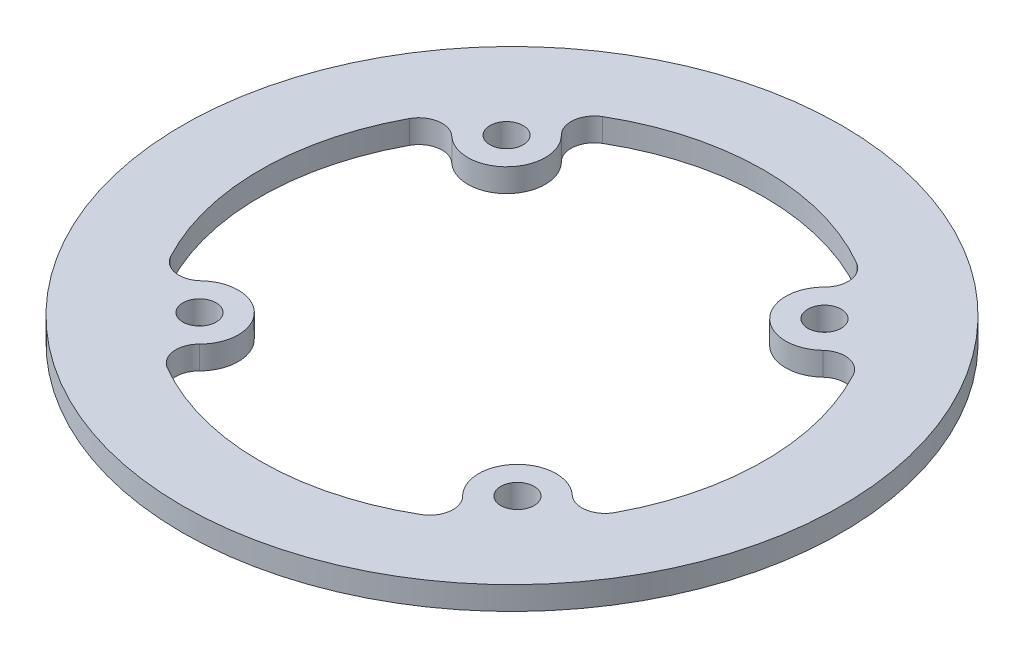
from build123d import *

# Parameters (mm, degrees)
SKETCH_1_R          = 45
SKETCH_1_R_2        = 2
EXTRUDE_1_DEPTH     = 3
CUT_EXTRUDE_1_DEPTH = 64.710281745
FILLET_1_R          = 3
MOVE_FACE_1_BY      = 2.5
MOVE_FACE_2_BY      = 0.15
MOVE_FACE_2_2_BY    = 0.15
MOVE_FACE_2_3_BY    = 0.15
MOVE_FACE_2_4_BY    = 0.15


with BuildPart() as part:
    # ｽｹｯﾁ1 → ﾎﾞｽ - 押し出し1 (new body)
    with BuildSketch(Plane(origin=(0, 0, 0), x_dir=(1, 0, 0), z_dir=(0, 1, 0))):
        with Locations(Location((0, 0, 0), (0, 0, 270))):
            Circle(SKETCH_1_R)
        with Locations(Location((-20.5, -19.798989873, 0), (0, 0, 270))):
            Circle(SKETCH_1_R_2, mode=Mode.SUBTRACT)
        with Locations(Location((20.5, -19.798989873, 0), (0, 0, 90))):
            Circle(SKETCH_1_R_2, mode=Mode.SUBTRACT)
        with Locations(Location((20.5, 19.798989873, 0), (0, 0, 270))):
            Circle(SKETCH_1_R_2, mode=Mode.SUBTRACT)
        with Locations(Location((-20.5, 19.798989873, 0), (0, 0, 90))):
            Circle(SKETCH_1_R_2, mode=Mode.SUBTRACT)
    extrude(amount=EXTRUDE_1_DEPTH)

    # ｽｹｯﾁ2 → ｶｯﾄ - 押し出し1 (cut, through all)
    with BuildSketch(Plane(origin=(0, 3, 0), x_dir=(1, 0, 0), z_dir=(0, 1, 0))):
        with BuildLine():
            ThreePointArc((25.486471606, -20.166550649), (30.696582279, -10.675665619), (32.5, 0))
            ThreePointArc((32.5, 0), (30.696582279, 10.675665619), (25.486471606, 20.166550649))
            ThreePointArc((25.486471606, 20.166550649), (25.496616757, 19.9828947), (25.5, 19.798989873))
            ThreePointArc((25.5, 19.798989873), (16.778183392, 16.460115641), (21.040767545, 24.769660901))
            ThreePointArc((21.040767545, 24.769660901), (0, 32.5), (-21.040767545, 24.769660901))
            ThreePointArc((-21.040767545, 24.769660901), (-17.161125768, 23.520806481), (-15.5, 19.798989873))
            ThreePointArc((-15.5, 19.798989873), (-20.683904827, 14.802373116), (-25.486471606, 20.166550649))
            ThreePointArc((-25.486471606, 20.166550649), (-32.5, 0), (-25.486471606, -20.166550649))
            ThreePointArc((-25.486471606, -20.166550649), (-20.683904827, -14.802373116), (-15.5, -19.798989873))
            ThreePointArc((-15.5, -19.798989873), (-17.161125768, -23.520806481), (-21.040767545, -24.769660901))
            ThreePointArc((-21.040767545, -24.769660901), (0, -32.5), (21.040767545, -24.769660901))
            ThreePointArc((21.040767545, -24.769660901), (16.778183392, -16.460115641), (25.5, -19.798989873))
            ThreePointArc((25.5, -19.798989873), (25.496616757, -19.9828947), (25.486471606, -20.166550649))
        make_face()
    extrude(amount=-CUT_EXTRUDE_1_DEPTH, mode=Mode.SUBTRACT)

    # ﾌｨﾚｯﾄ1
    fillet_1_edges = [part.edges().sort_by_distance(p)[0] for p in [
        (21.040767545, 1.5, -24.769660901),
        (25.486471606, 1.5, -20.166550649),
        (25.486471606, 1.5, 20.166550649),
        (21.040767545, 1.5, 24.769660901),
        (-21.040767545, 1.5, 24.769660901),
        (-25.486471606, 1.5, 20.166550649),
        (-25.486471606, 1.5, -20.166550649),
        (-21.040767545, 1.5, -24.769660901),
    ]]
    fillet(fillet_1_edges, radius=FILLET_1_R)

    # Move Face 1: a curved face moved inward by 2.5
    add(Solid.thicken(part.faces().sort_by_distance((0, 1.5, -45))[0], -MOVE_FACE_1_BY), mode=Mode.SUBTRACT)

    # Move Face 2: a curved face moved inward by 0.15
    add(Solid.thicken(part.faces().sort_by_distance((20.5, 1.5, -21.798989873))[0], -MOVE_FACE_2_BY), mode=Mode.SUBTRACT)

    # Move Face 2 2: a curved face moved inward by 0.15
    add(Solid.thicken(part.faces().sort_by_distance((-20.5, 1.5, -17.798989873))[0], -MOVE_FACE_2_2_BY), mode=Mode.SUBTRACT)

    # Move Face 2 3: a curved face moved inward by 0.15
    add(Solid.thicken(part.faces().sort_by_distance((-20.5, 1.5, 17.798989873))[0], -MOVE_FACE_2_3_BY), mode=Mode.SUBTRACT)

    # Move Face 2 4: a curved face moved inward by 0.15
    add(Solid.thicken(part.faces().sort_by_distance((20.5, 1.5, 21.798989873))[0], -MOVE_FACE_2_4_BY), mode=Mode.SUBTRACT)


solid = part.part
